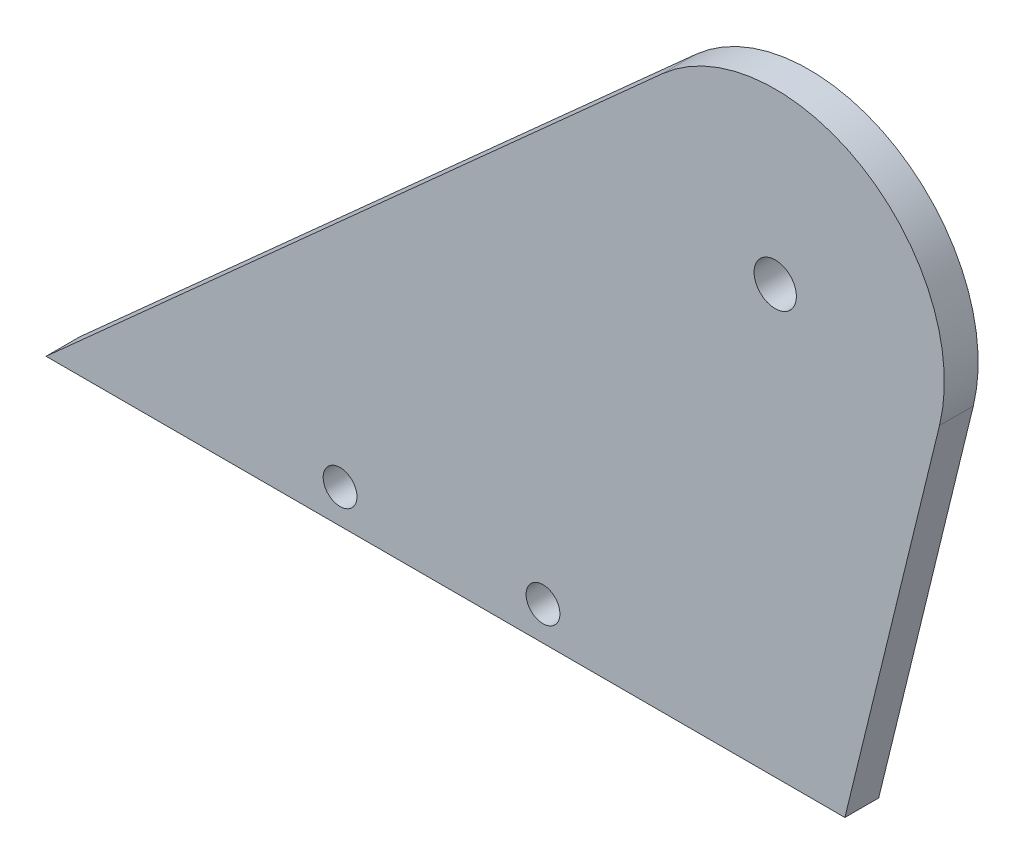
from build123d import *

# Parameters (mm, degrees)
SKETCH_1_R      = 1.25
SKETCH_1_R_2    = 1
EXTRUDE_1_DEPTH = 2


with BuildPart() as part:
    # 草圖1 → 填料-伸長1 (new body)
    with BuildSketch(Plane.XY):
        with BuildLine():
            Line((-41.078680873, -25.246867961), (3.125001345, -25.246867961))
            Line((3.125001345, -25.246867961), (4.118524153, -25.246867961))
            Line((4.118524153, -25.246867961), (9.71355395, -2.376314303))
            ThreePointArc((9.71355395, -2.376314303), (5.139430957, 8.578242795), (-6.677431122, 7.443917894))
            Line((-6.677431122, 7.443917894), (-43.120716176, -25.246867961))
            Line((-43.120716176, -25.246867961), (-41.078680873, -25.246867961))
        make_face()
        Circle(SKETCH_1_R, mode=Mode.SUBTRACT)
        with Locations((-25.732609449, -23.246867961)):
            Circle(SKETCH_1_R_2, mode=Mode.SUBTRACT)
        with Locations((-13.732609449, -23.246867961)):
            Circle(SKETCH_1_R_2, mode=Mode.SUBTRACT)
    extrude(amount=EXTRUDE_1_DEPTH)


solid = part.part
